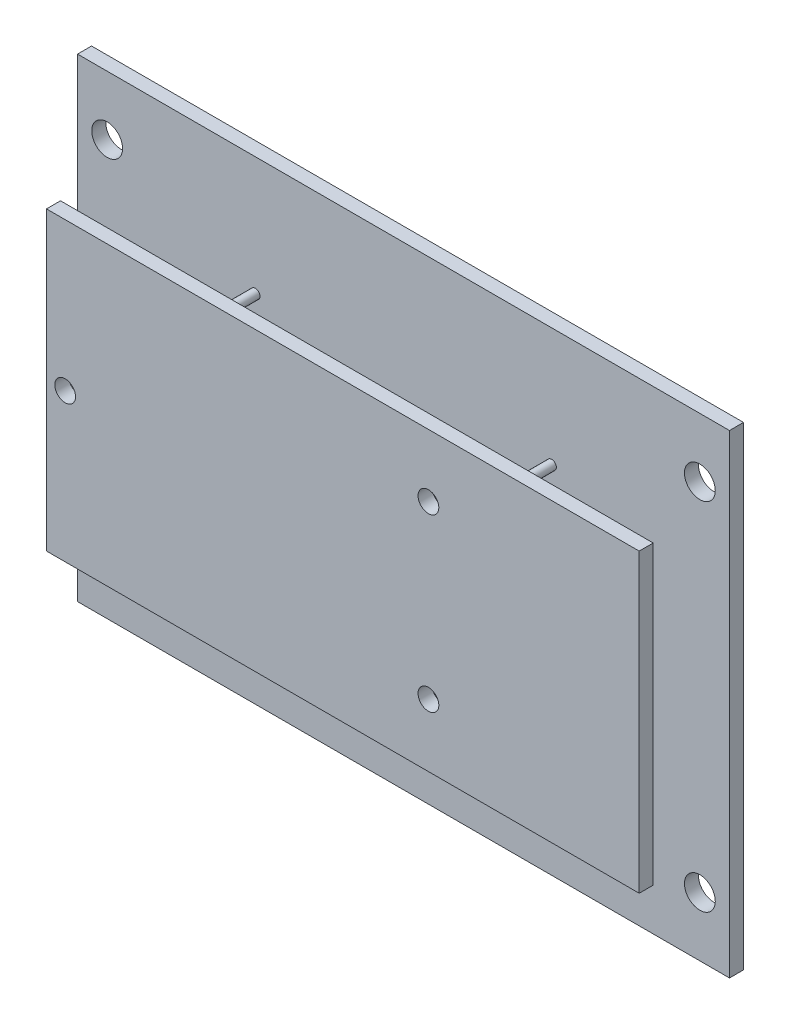
from build123d import *

# Parameters (mm, degrees)
SKETCH1_W                      = 139.7
SKETCH1_H                      = 101.6
BOSS_EXTRUDE1_DEPTH            = 3
SKETCH2_R                      = 1
BOSS_EXTRUDE2_DEPTH            = 13
SKETCH3_W                      = 127
SKETCH3_H                      = 63.5
BOSS_EXTRUDE3_DEPTH            = 3
CUT_EXTRUDE1_DEPTH             = 88.342214879
CUT_EXTRUDE1_DEPTH_BACK        = 88.342214879
SKETCH4_R                      = 3.302
CUT_EXTRUDE2_REACH             = 89.839
SKETCH5_R                      = 2.2225
CUT_EXTRUDE2_DIRECTION_2_DEPTH = 88.838843913


with BuildPart() as part:
    # Sketch1 → Boss-Extrude1 (new body)
    with BuildSketch(Plane.XY):
        Rectangle(SKETCH1_W, SKETCH1_H)
    extrude(amount=BOSS_EXTRUDE1_DEPTH)

    # Sketch2 → Boss-Extrude2 (add)
    with BuildSketch(Plane.XY.offset(3)):
        with Locations(Location((-31.75, 25.4, 0), (0, 0, 180))):
            Circle(SKETCH2_R)
        with Locations(Location((31.75, 25.4, 0), (0, 0, 180))):
            Circle(SKETCH2_R)
        with Locations(Location((31.75, -25.4, 0), (0, 0, 180))):
            Circle(SKETCH2_R)
        with Locations(Location((-31.75, -25.4, 0), (0, 0, 180))):
            Circle(SKETCH2_R)
    extrude(amount=BOSS_EXTRUDE2_DEPTH)

    # Sketch3 → Boss-Extrude3 (add)
    with BuildSketch(Plane.XY.offset(16)):
        Rectangle(SKETCH3_W, SKETCH3_H)
    extrude(amount=-BOSS_EXTRUDE3_DEPTH)

    # Sketch4 → Cut-Extrude1 (cut, two sides: drawn at the far end of the back side and taken through both)
    with BuildSketch(Plane.XY.offset(3).offset(-CUT_EXTRUDE1_DEPTH_BACK)):
        with Locations((-63.5, -38.1)):
            Circle(SKETCH4_R)
        with Locations((63.5, 38.1)):
            Circle(SKETCH4_R)
        with Locations((-63.5, 38.1)):
            Circle(SKETCH4_R)
        with Locations((63.5, -38.1)):
            Circle(SKETCH4_R)
    extrude(amount=CUT_EXTRUDE1_DEPTH + CUT_EXTRUDE1_DEPTH_BACK, mode=Mode.SUBTRACT)

    # Sketch5 → Cut-Extrude2 (cut, up to next)
    with BuildSketch(Plane.XY.offset(16), mode=Mode.PRIVATE) as cut_extrude2_sk1:
        with Locations(Location((-59.5, 0, 0), (0, 0, 180))):
            Circle(SKETCH5_R)
    cut_extrude2_tool1 = extrude(cut_extrude2_sk1.sketch, amount=-CUT_EXTRUDE2_REACH, mode=Mode.PRIVATE) & part.part
    # Sketch5 → Cut-Extrude2 (cut, up to next)
    with BuildSketch(Plane.XY.offset(16), mode=Mode.PRIVATE) as cut_extrude2_sk2:
        with Locations(Location((18.338183986, -18.338183986, 0), (0, 0, 180))):
            Circle(SKETCH5_R)
    cut_extrude2_tool2 = extrude(cut_extrude2_sk2.sketch, amount=-CUT_EXTRUDE2_REACH, mode=Mode.PRIVATE) & part.part
    # Sketch5 → Cut-Extrude2 (cut, up to next)
    with BuildSketch(Plane.XY.offset(16), mode=Mode.PRIVATE) as cut_extrude2_sk3:
        with Locations(Location((18.338183986, 18.338183986, 0), (0, 0, 180))):
            Circle(SKETCH5_R)
    cut_extrude2_tool3 = extrude(cut_extrude2_sk3.sketch, amount=-CUT_EXTRUDE2_REACH, mode=Mode.PRIVATE) & part.part
    add(cut_extrude2_tool1.solids().sort_by_distance((-59.5, 0, 16))[0], mode=Mode.SUBTRACT)
    add(cut_extrude2_tool2.solids().sort_by_distance((18.338184, -18.338184, 16))[0], mode=Mode.SUBTRACT)
    add(cut_extrude2_tool3.solids().sort_by_distance((18.338184, 18.338184, 16))[0], mode=Mode.SUBTRACT)

    # Sketch5 → Cut-Extrude2 direction 2 (cut)
    with BuildSketch(Plane.XY.offset(16)):
        with Locations(Location((-59.5, 0, 0), (0, 0, 180))):
            Circle(SKETCH5_R)
        with Locations(Location((18.338183986, -18.338183986, 0), (0, 0, 180))):
            Circle(SKETCH5_R)
        with Locations(Location((18.338183986, 18.338183986, 0), (0, 0, 180))):
            Circle(SKETCH5_R)
    extrude(amount=CUT_EXTRUDE2_DIRECTION_2_DEPTH, mode=Mode.SUBTRACT)


solid = part.part
